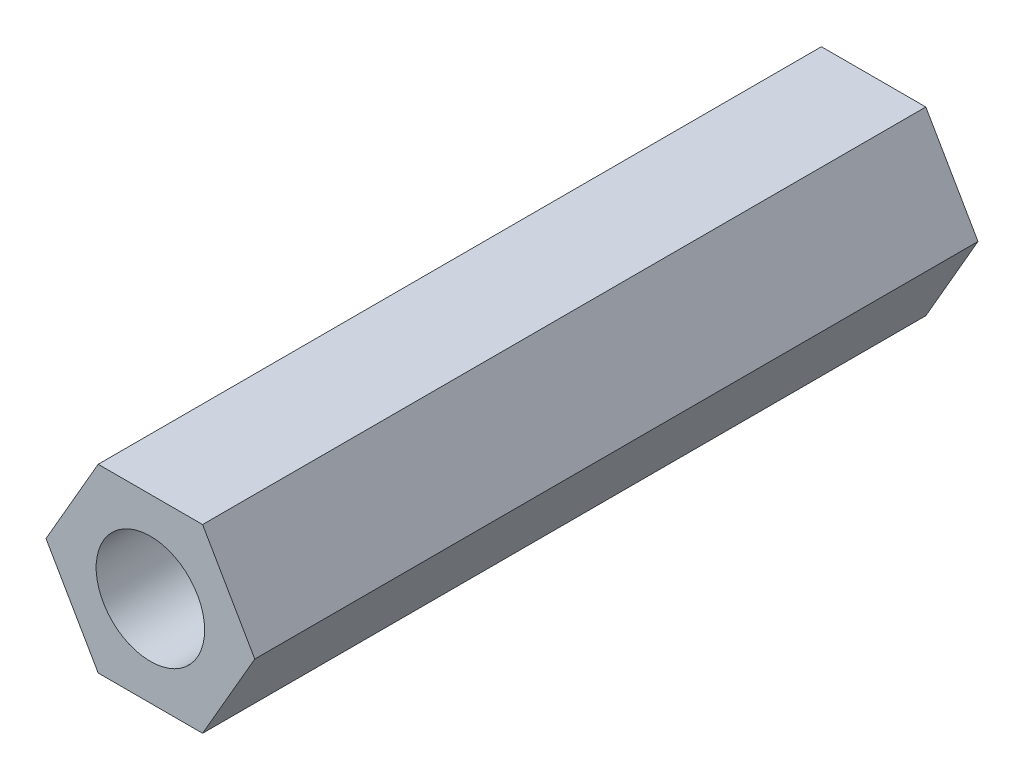
from build123d import *

# Parameters (mm, degrees)
ESQUISSE1_R        = 1.5
BOSS_EXTRU_1_DEPTH = 20


with BuildPart() as part:
    # Esquisse1 → Boss.-Extru.1 (new body)
    with BuildSketch(Plane.XY):
        Polygon((1.443375673, 2.5), (-1.443375673, 2.5), (-2.886751346, 0), (-1.443375673, -2.5), (1.443375673, -2.5), (2.886751346, 0), align=None)
        Circle(ESQUISSE1_R, mode=Mode.SUBTRACT)
    extrude(amount=BOSS_EXTRU_1_DEPTH)


solid = part.part
